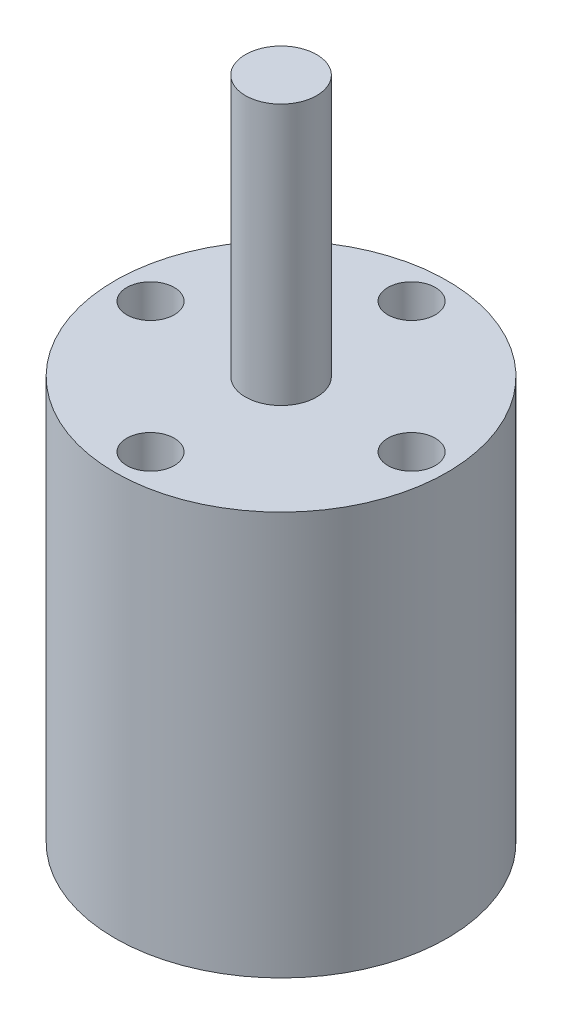
from build123d import *

# Parameters (mm, degrees)
SKETCH_1_R          = 7
EXTRUDE_1_DEPTH     = 17
SKETCH_2_R          = 1.5
EXTRUDE_3_DEPTH     = 11
SKETCH_4_R          = 1
CUT_EXTRUDE_1_DEPTH = 5


with BuildPart() as part:
    # 草图1 → 凸台-拉伸1 (new body)
    with BuildSketch(Plane(origin=(0, 0, 0), x_dir=(1, 0, 0), z_dir=(0, 1, 0))):
        with Locations(Location((0, 0, 0), (0, 0, 270))):
            Circle(SKETCH_1_R)
    extrude(amount=EXTRUDE_1_DEPTH)

    # 草图2 → 凸台-拉伸3 (add)
    with BuildSketch(Plane(origin=(0, 17, 0), x_dir=(1, 0, 0), z_dir=(0, 1, 0))):
        with Locations(Location((0, 0, 0), (0, 0, 270))):
            Circle(SKETCH_2_R)
    extrude(amount=EXTRUDE_3_DEPTH)

    # 草图4 → 切除-拉伸1 (cut)
    with BuildSketch(Plane(origin=(0, 17, 0), x_dir=(1, 0, 0), z_dir=(0, 1, 0))):
        with Locations(Location((0, -5.5, 0), (0, 0, 270))):
            Circle(SKETCH_4_R)
        with Locations(Location((-5.5, 0, 0), (0, 0, 270))):
            Circle(SKETCH_4_R)
        with Locations(Location((0, 5.5, 0), (0, 0, 270))):
            Circle(SKETCH_4_R)
        with Locations(Location((5.5, 0, 0), (0, 0, 270))):
            Circle(SKETCH_4_R)
    extrude(amount=-CUT_EXTRUDE_1_DEPTH, mode=Mode.SUBTRACT)


solid = part.part
